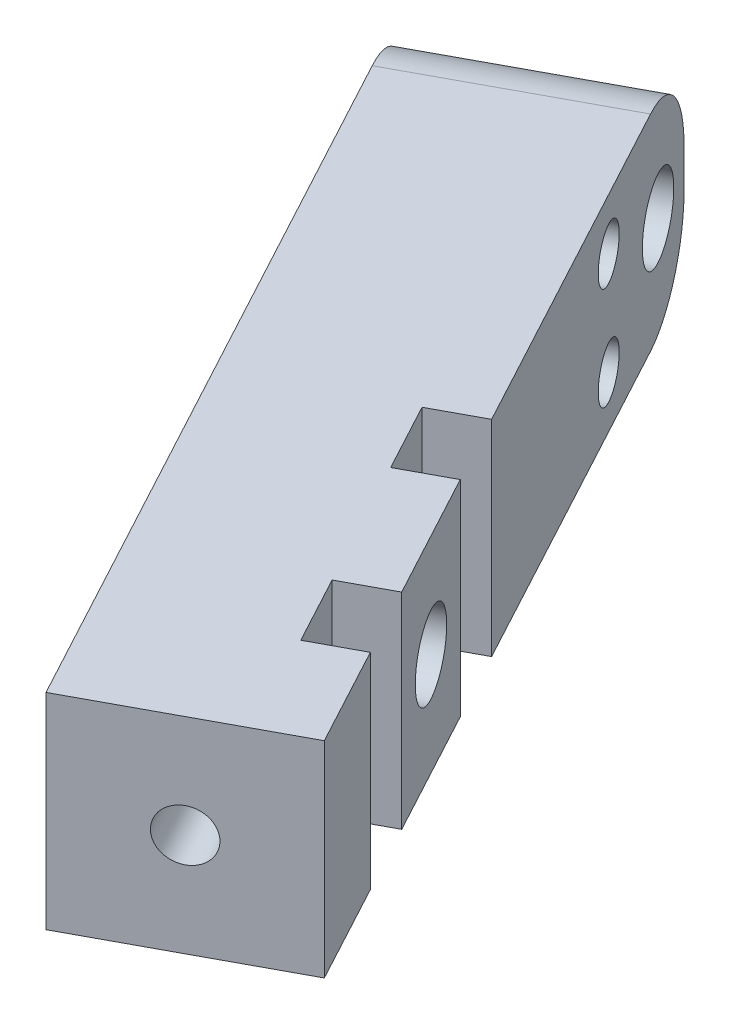
from build123d import *

# Parameters (mm, degrees)
BOSS_EXTRUDE1_DEPTH = 1000
CUT_EXTRUDE2_REACH  = 4048.723
SKETCH2_R           = 187.5
SKETCH5_W           = 1000
SKETCH5_H           = 1000
BOSS_EXTRUDE2_DEPTH = 310
FILLET1_R           = 400
SKETCH6_R           = 187.5
CUT_EXTRUDE3_DEPTH  = 650
CUT_EXTRUDE4_REACH  = 4344.256
SKETCH7_R           = 125
SKETCH8_R           = 125
CUT_EXTRUDE5_DEPTH  = 700


with BuildPart() as part:
    # Sketch1 → Boss-Extrude1 (new body)
    with BuildSketch(Plane(origin=(0, 0, 0), x_dir=(1, 0, 0), z_dir=(0, 1, 0))):
        Polygon((473.518002347, -385.070267513), (212.989409896, 99.310628596), (-7.183724699, -19.111458882), (-184.816855916, 311.148243011), (35.356278679, 429.570330489), (-296.225566259, 1046.055107355), (-516.398700854, 927.633019877), (-694.031832071, 1257.892721769), (-473.858697476, 1376.314809247), (-1416.4985138, 3128.892960623), (-2297.19105218, 2655.204610711), (-407.174536033, -858.758617424), align=None)
    extrude(amount=BOSS_EXTRUDE1_DEPTH)

    # Sketch2 → Cut-Extrude2 (cut, up to next)
    with BuildSketch(Plane(origin=(206.628498898, 0, -111.13698416), x_dir=(-0.47368834991159353, 0, -0.8806925383799001), z_dir=(0.8806925383799001, 0, -0.47368834991159353)), mode=Mode.PRIVATE) as cut_extrude2_sk1:
        with Locations((711.571527464, 500)):
            Circle(SKETCH2_R)
    cut_extrude2_tool1 = extrude(cut_extrude2_sk1.sketch, amount=-CUT_EXTRUDE2_REACH, mode=Mode.PRIVATE) & part.part
    add(cut_extrude2_tool1.solids().sort_by_distance((-130.434644, 500, -737.812719))[0], mode=Mode.SUBTRACT)

    # Sketch5 → Boss-Extrude2 (add)
    with BuildSketch(Plane(origin=(-1623.127012699, 0, -3017.755976463), x_dir=(-0.8806925383799005, 0, 0.4736883499115927), z_dir=(-0.4736883499115927, 0, -0.8806925383799005))):
        with Locations((265.379528163, 500)):
            Rectangle(SKETCH5_W, SKETCH5_H)
    extrude(amount=BOSS_EXTRUDE2_DEPTH)

    # Fillet1
    fillet1_edges = [part.edges().sort_by_distance(p)[0] for p in [
        (-2003.688171463, 0, -3165.063472565),
        (-2003.688171463, 1000, -3165.063472565),
    ]]
    fillet(fillet1_edges, radius=FILLET1_R)

    # Sketch6 → Cut-Extrude3 (cut)
    with BuildSketch(Plane(origin=(206.628498898, 0, -111.13698416), x_dir=(-0.4736883499115939, 0, -0.8806925383798999), z_dir=(0.8806925383798999, 0, -0.4736883499115939))):
        with Locations((3426.571527464, 500)):
            Circle(SKETCH6_R)
    extrude(amount=-CUT_EXTRUDE3_DEPTH, mode=Mode.SUBTRACT)

    # Sketch7 → Cut-Extrude4 (cut, up to next)
    with BuildSketch(Plane(origin=(206.628498898, 0, -111.13698416), x_dir=(-0.4736883499115939, 0, -0.8806925383798999), z_dir=(0.8806925383798999, 0, -0.4736883499115939)), mode=Mode.PRIVATE) as cut_extrude4_sk1:
        with Locations((2836.571527464, 750)):
            Circle(SKETCH7_R)
    cut_extrude4_tool1 = extrude(cut_extrude4_sk1.sketch, amount=-CUT_EXTRUDE4_REACH, mode=Mode.PRIVATE) & part.part
    # Sketch7 → Cut-Extrude4 (cut, up to next)
    with BuildSketch(Plane(origin=(206.628498898, 0, -111.13698416), x_dir=(-0.4736883499115939, 0, -0.8806925383798999), z_dir=(0.8806925383798999, 0, -0.4736883499115939)), mode=Mode.PRIVATE) as cut_extrude4_sk2:
        with Locations((2836.571527464, 250)):
            Circle(SKETCH7_R)
    cut_extrude4_tool2 = extrude(cut_extrude4_sk2.sketch, amount=-CUT_EXTRUDE4_REACH, mode=Mode.PRIVATE) & part.part
    add(cut_extrude4_tool1.solids().sort_by_distance((-1137.022387, 750, -2609.284363))[0], mode=Mode.SUBTRACT)
    add(cut_extrude4_tool2.solids().sort_by_distance((-1137.022387, 250, -2609.284363))[0], mode=Mode.SUBTRACT)

    # Sketch8 → Cut-Extrude5 (cut)
    with BuildSketch(Plane(origin=(266.889503449, 0, 496.207251673), x_dir=(0.8806925383799001, 0, -0.4736883499115936), z_dir=(0.4736883499115936, 0, 0.8806925383799001))):
        with Locations((-265.379528163, 500)):
            Circle(SKETCH8_R)
    extrude(amount=-CUT_EXTRUDE5_DEPTH, mode=Mode.SUBTRACT)


solid = part.part
